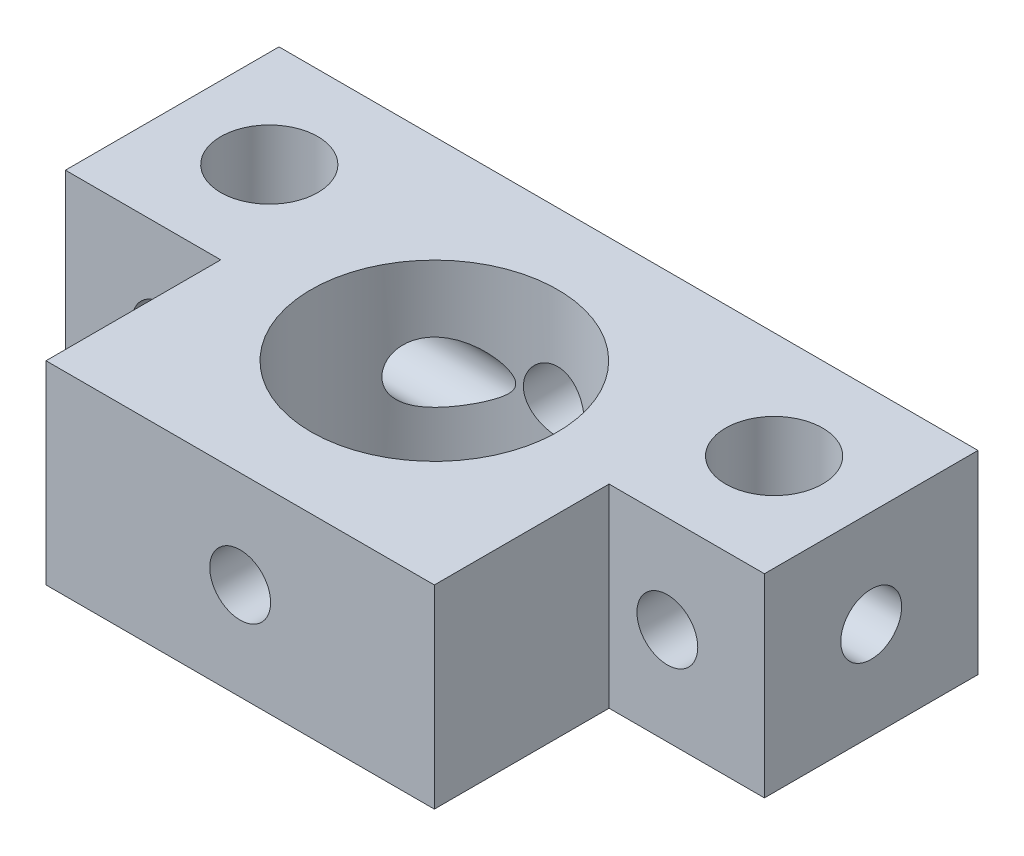
from build123d import *

# Parameters (mm, degrees)
SKETCH1_W                  = 18
SKETCH1_H                  = 10
BOSS_EXTRUDE1_DEPTH        = 5
SKETCH2_W                  = 4
SKETCH2_H                  = 4.5
CUT_EXTRUDE1_DEPTH         = 15.352700094
SKETCH3_W                  = 4
SKETCH3_H                  = 4.5
CUT_EXTRUDE2_DEPTH         = 15.352700094
F_2_5_2_5_DIAMETER_HOLE1_D = 2.5
HOLE1_D                    = 1.567
HOLE1_DEPTH                = 19.526024769
HOLE2_D                    = 1.567
HOLE2_DEPTH                = 7.276024769
HOLE3_D                    = 6.35
HOLE4_D                    = 1.567
HOLE4_DEPTH                = 11.923191142


with BuildPart() as part:
    # Sketch1 → Boss-Extrude1 (new body)
    with BuildSketch(Plane.XZ.offset(5)):
        with Locations((0, 5)):
            Rectangle(SKETCH1_W, SKETCH1_H)
    extrude(amount=-BOSS_EXTRUDE1_DEPTH)

    # Sketch2 → Cut-Extrude1 (cut, through all)
    with BuildSketch(Plane(origin=(0, 0, 0), x_dir=(-1, 0, 0), z_dir=(0, 1, 0))):
        with Locations((7, 7.75)):
            Rectangle(SKETCH2_W, SKETCH2_H)
    extrude(amount=-CUT_EXTRUDE1_DEPTH, mode=Mode.SUBTRACT)

    # Sketch3 → Cut-Extrude2 (cut, through all)
    with BuildSketch(Plane(origin=(0, 0, 0), x_dir=(-1, 0, 0), z_dir=(0, 1, 0))):
        with Locations((-7, 7.75)):
            Rectangle(SKETCH3_W, SKETCH3_H)
    extrude(amount=-CUT_EXTRUDE2_DEPTH, mode=Mode.SUBTRACT)

    # Ø2.5 (2.5) Diameter Hole1 (through all)
    with Locations(Plane(origin=(0, 0, 0), x_dir=(1, 0, 0), z_dir=(0, 1, 0))):
        with Locations((6.5, -2.75), (-6.5, -2.75)):
            Hole(F_2_5_2_5_DIAMETER_HOLE1_D / 2)

    # Hole1
    with Locations(Plane(origin=(9, 0, 0), x_dir=(0, 0, -1), z_dir=(1, 0, 0))):
        with Locations((-2.75, -2.5)):
            Hole(HOLE1_D / 2, depth=HOLE1_DEPTH)

    # Hole2
    with Locations(Plane.XY.offset(5.5)):
        with Locations((6.5, -2.5), (-6.5, -2.5)):
            Hole(HOLE2_D / 2, depth=HOLE2_DEPTH)

    # Hole3 (through all)
    with Locations(Plane(origin=(0, 0, 0), x_dir=(1, 0, 0), z_dir=(0, 1, 0))):
        with Locations((0, -5)):
            Hole(HOLE3_D / 2)

    # Hole4
    with Locations(Plane.XY.offset(10)):
        with Locations((0, -2.5)):
            Hole(HOLE4_D / 2, depth=HOLE4_DEPTH)


solid = part.part
